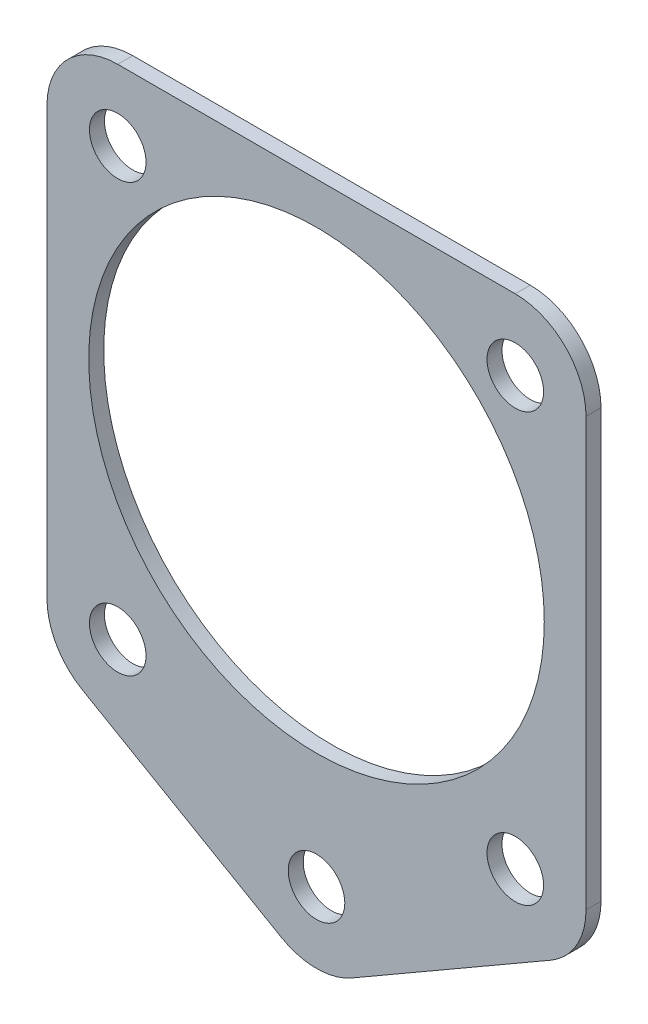
from build123d import *

# Parameters (mm, degrees)
SKETCH1_R           = 2.54
SKETCH1_R_2         = 20.447
BOSS_EXTRUDE1_DEPTH = 1.3462


with BuildPart() as part:
    # Sketch1 → Boss-Extrude1 (new body)
    with BuildSketch(Plane.XY):
        with BuildLine():
            Line((48.387, 3.666174209), (48.387, 42.037))
            ThreePointArc((48.387, 42.037), (46.527128061, 46.527128061), (42.037, 48.387))
            Line((42.037, 48.387), (6.35, 48.387))
            ThreePointArc((6.35, 48.387), (1.859871939, 46.527128061), (0, 42.037))
            Line((0, 42.037), (0, 3.666174209))
            ThreePointArc((0, 3.666174209), (0.850738686, 0.491174209), (3.175, -1.833087105))
            Line((3.175, -1.833087105), (21.0185, -12.135036633))
            ThreePointArc((21.0185, -12.135036633), (24.1935, -12.985775319), (27.3685, -12.135036633))
            Line((27.3685, -12.135036633), (45.212, -1.833087105))
            ThreePointArc((45.212, -1.833087105), (47.536261314, 0.491174209), (48.387, 3.666174209))
        make_face()
        with Locations((6.35, 42.037)):
            Circle(SKETCH1_R, mode=Mode.SUBTRACT)
        with Locations((42.037, 42.037)):
            Circle(SKETCH1_R, mode=Mode.SUBTRACT)
        with Locations((42.037, 3.666174209)):
            Circle(SKETCH1_R, mode=Mode.SUBTRACT)
        with Locations((6.35, 3.666174209)):
            Circle(SKETCH1_R, mode=Mode.SUBTRACT)
        with Locations((24.1935, -6.635775319)):
            Circle(SKETCH1_R, mode=Mode.SUBTRACT)
        with Locations((24.1935, 24.1935)):
            Circle(SKETCH1_R_2, mode=Mode.SUBTRACT)
    extrude(amount=BOSS_EXTRUDE1_DEPTH)


solid = part.part
